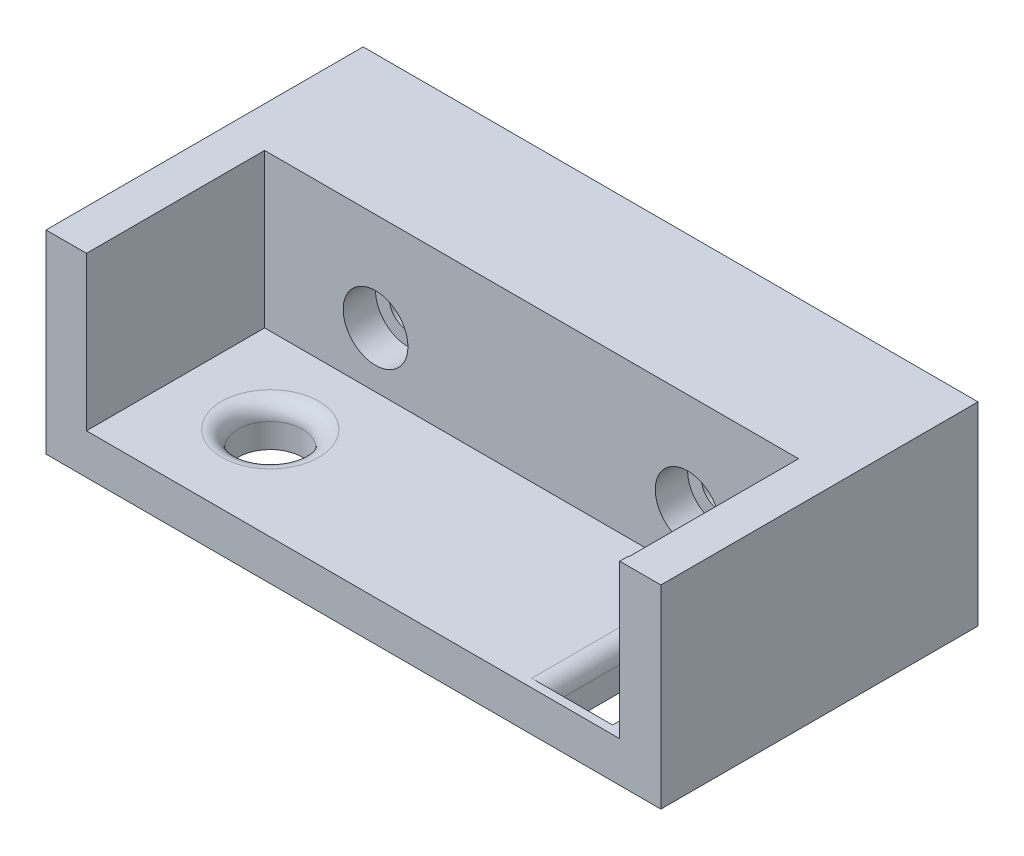
from build123d import *

# Parameters (mm, degrees)
SKETCH_1_W               = 76
SKETCH_1_H               = 31
SKETCH_1_W_2             = 66
SKETCH_1_H_2             = 21
EXTRUDE_1_DEPTH          = 19
SKETCH_3_W               = 76
SKETCH_3_H               = 31
SKETCH_3_R               = 4
SKETCH_3_W_2             = 8
SKETCH_3_H_2             = 22.5
EXTRUDE_3_DEPTH          = 5
FILLET_1_R               = 2
FILLET_2_R               = 2
CUT_EXTRUDE_2_DEPTH      = 46.224440295
CUT_EXTRUDE_2_DEPTH_BACK = 46.224440295
SKETCH_5_W               = 76.758909218
SKETCH_5_H               = 3.977461231
SKETCH_6_W               = 76
SKETCH_6_H               = 24
EXTRUDE_4_DEPTH          = 12.177461231
SKETCH_8_R               = 2.3
CUT_EXTRUDE_5_DEPTH      = 58.806920001
SKETCH_13_W              = 65.911954831
SKETCH_13_H              = 1.022538769
CUT_EXTRUDE_6_DEPTH      = 19
SKETCH_14_R              = 4
CUT_EXTRUDE_7_DEPTH      = 4


with BuildPart() as part:
    # 草圖1 → 填料-伸長1 (new body)
    with BuildSketch(Plane(origin=(0, 0, 0), x_dir=(1, 0, 0), z_dir=(0, 1, 0))):
        Rectangle(SKETCH_1_W, SKETCH_1_H)
        Rectangle(SKETCH_1_W_2, SKETCH_1_H_2, mode=Mode.SUBTRACT)
    extrude(amount=EXTRUDE_1_DEPTH)

    # 草圖3 → 填料-伸長3 (add)
    with BuildSketch(Plane(origin=(0, 0, 0), x_dir=(1, 0, 0), z_dir=(0, 1, 0))):
        Rectangle(SKETCH_3_W, SKETCH_3_H)
        with Locations(Location((-21.8, 0, 0), (0, 0, 270))):
            Circle(SKETCH_3_R, mode=Mode.SUBTRACT)
        with Locations((27, 0.75)):
            Rectangle(SKETCH_3_W_2, SKETCH_3_H_2, mode=Mode.SUBTRACT)
    extrude(amount=-EXTRUDE_3_DEPTH)

    # 圓角1
    fillet_1_edges = [part.edges().sort_by_distance(p)[0] for p in [
        (-21.8, 0, -4),
    ]]
    fillet(fillet_1_edges, radius=FILLET_1_R)

    # 圓角2
    fillet_2_edges = [part.edges().sort_by_distance(p)[0] for p in [
        (23, 0, 0),
    ]]
    fillet(fillet_2_edges, radius=FILLET_2_R)

    # 草圖5 → 除料-伸長2 (cut, two sides: drawn at the far end of the back side and taken through both)
    with BuildSketch(Plane(origin=(0, 0, 0), x_dir=(1, 0, 0), z_dir=(0, 1, 0)).offset(-CUT_EXTRUDE_2_DEPTH_BACK)):
        with Locations((0.379454609, -13.511269385)):
            Rectangle(SKETCH_5_W, SKETCH_5_H)
    extrude(amount=CUT_EXTRUDE_2_DEPTH + CUT_EXTRUDE_2_DEPTH_BACK, mode=Mode.SUBTRACT)

    # 草圖6 → 填料-伸長4 (add)
    with BuildSketch(Plane.XY.offset(-27.677461231)):
        with Locations((0, 7)):
            Rectangle(SKETCH_6_W, SKETCH_6_H)
    extrude(amount=EXTRUDE_4_DEPTH)

    # 草圖8 → 除料-伸長5 (cut, through all)
    with BuildSketch(Plane.XY.offset(-27.677461231)):
        with Locations((19.287892817, 6.851763466)):
            Circle(SKETCH_8_R)
        with Locations(Location((-19.287892817, 6.851763466, 0), (0, 0, 180))):
            Circle(SKETCH_8_R)
    extrude(amount=CUT_EXTRUDE_5_DEPTH, mode=Mode.SUBTRACT)

    # 草圖13 → 除料-伸長6 (cut)
    with BuildSketch(Plane(origin=(0, 19, 0), x_dir=(1, 0, 0), z_dir=(0, 1, 0))):
        with Locations((-0.044022584, -11.011269385)):
            Rectangle(SKETCH_13_W, SKETCH_13_H)
    extrude(amount=-CUT_EXTRUDE_6_DEPTH, mode=Mode.SUBTRACT)

    # 草圖14 → 除料-伸長7 (cut)
    with BuildSketch(Plane.XY.offset(-10.5)):
        with Locations((-19.287892817, 6.851763466)):
            Circle(SKETCH_14_R)
        with Locations((19.287892817, 6.851763466)):
            Circle(SKETCH_14_R)
    extrude(amount=-CUT_EXTRUDE_7_DEPTH, mode=Mode.SUBTRACT)


solid = part.part
